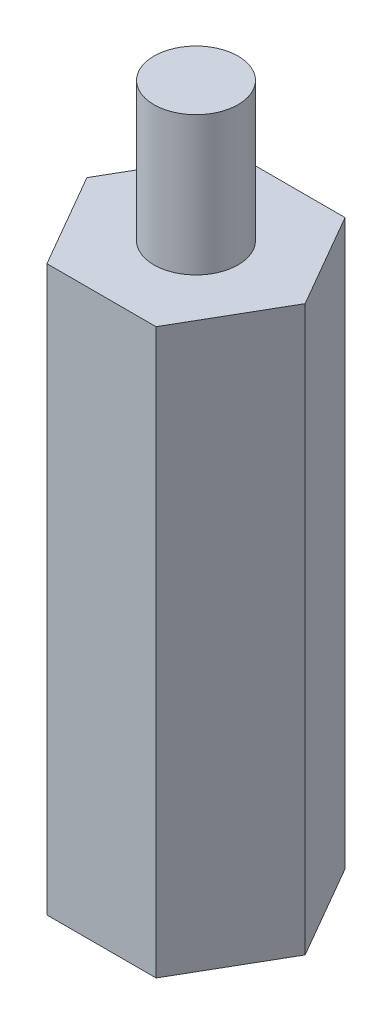
from build123d import *

# Parameters (mm, degrees)
BOSS_EXTRUDE1_DEPTH = 19.1
SKETCH2_R           = 1.425
BOSS_EXTRUDE2_DEPTH = 4.7
SKETCH3_R           = 1.425
CUT_EXTRUDE1_DEPTH  = 4


with BuildPart() as part:
    # Sketch1 → Boss-Extrude1 (new body)
    with BuildSketch(Plane(origin=(0, 0, 0), x_dir=(1, 0, 0), z_dir=(0, 1, 0))):
        Polygon((1.847520861, 3.2), (-1.847520861, 3.2), (-3.695041723, 0), (-1.847520861, -3.2), (1.847520861, -3.2), (3.695041723, 0), align=None)
    extrude(amount=BOSS_EXTRUDE1_DEPTH)

    # Sketch2 → Boss-Extrude2 (add)
    with BuildSketch(Plane(origin=(0, 19.1, 0), x_dir=(1, 0, 0), z_dir=(0, 1, 0))):
        with Locations(Location((0, 0, 0), (0, 0, 270))):
            Circle(SKETCH2_R)
    extrude(amount=BOSS_EXTRUDE2_DEPTH)

    # Sketch3 → Cut-Extrude1 (cut)
    with BuildSketch(Plane.XZ):
        with Locations(Location((0, 0, 0), (0, 0, 90))):
            Circle(SKETCH3_R)
    extrude(amount=-CUT_EXTRUDE1_DEPTH, mode=Mode.SUBTRACT)


solid = part.part
